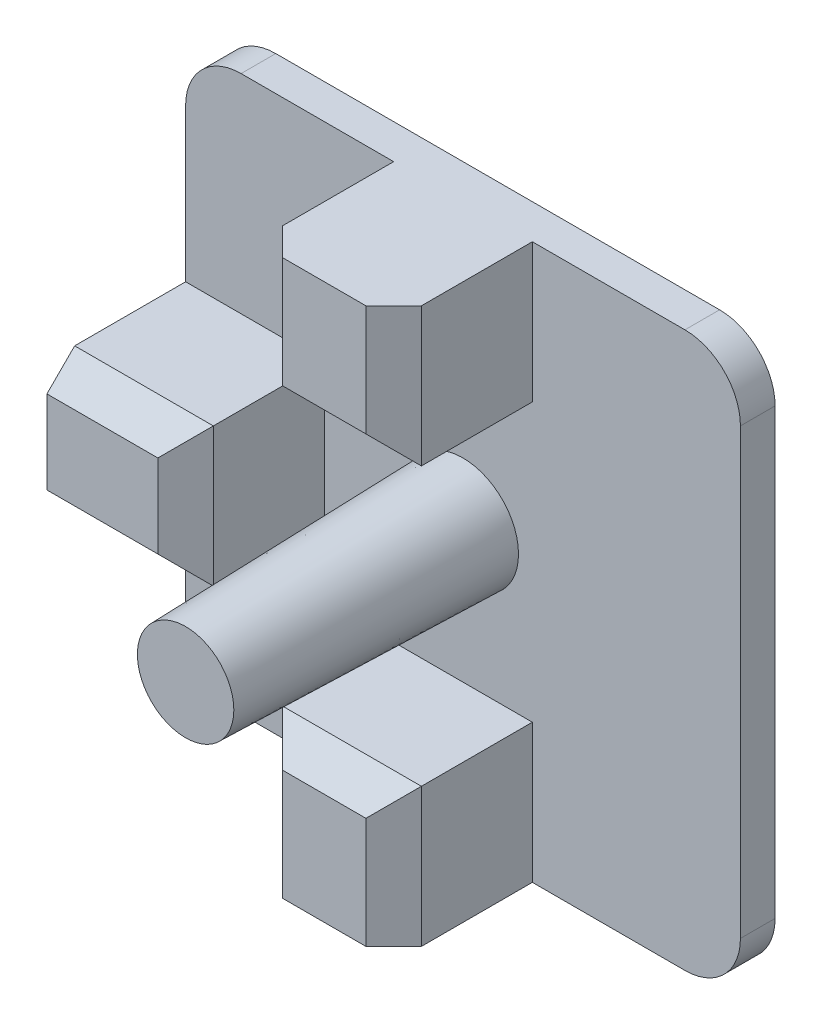
from build123d import *

# Parameters (mm, degrees)
BOSS_EXTRUDE1_DEPTH = 1.5875
SKETCH2_W           = 6.35
SKETCH2_H           = 6.35
BOSS_EXTRUDE3_DEPTH = 6.35
SKETCH2_4_R         = 2.54
BOSS_EXTRUDE4_DEPTH = 12.7
BOSS_EXTRUDE4_TAPER = 1.5
CHAMFER1_SIZE       = 1.27
CUT_EXTRUDE1_DEPTH  = 0.6


with BuildPart() as part:
    # Sketch1 → Boss-Extrude1 (new body)
    with BuildSketch(Plane.XY):
        with BuildLine():
            Line((-10.16, 12.7), (10.16, 12.7))
            ThreePointArc((10.16, 12.7), (11.956051224, 11.956051224), (12.7, 10.16))
            Line((12.7, 10.16), (12.7, -10.16))
            ThreePointArc((12.7, -10.16), (11.956051224, -11.956051224), (10.16, -12.7))
            Line((10.16, -12.7), (-10.16, -12.7))
            ThreePointArc((-10.16, -12.7), (-11.956051224, -11.956051224), (-12.7, -10.16))
            Line((-12.7, -10.16), (-12.7, 10.16))
            ThreePointArc((-12.7, 10.16), (-11.956051224, 11.956051224), (-10.16, 12.7))
        make_face()
    extrude(amount=BOSS_EXTRUDE1_DEPTH)

    # Sketch2 → Boss-Extrude3 (add)
    with BuildSketch(Plane.XY.offset(1.5875)):
        with Locations((-9.525, 0)):
            Rectangle(SKETCH2_W, SKETCH2_H)
        with Locations((0, 9.525)):
            Rectangle(SKETCH2_W, SKETCH2_H)
        with Locations((0, -9.525)):
            Rectangle(SKETCH2_W, SKETCH2_H)
    extrude(amount=BOSS_EXTRUDE3_DEPTH)

    # Sketch2<4> → Boss-Extrude4 (add)
    with BuildSketch(Plane.XY.offset(1.5875)):
        Circle(SKETCH2_4_R)
    extrude(amount=BOSS_EXTRUDE4_DEPTH, taper=BOSS_EXTRUDE4_TAPER)

    # Chamfer1
    chamfer1_edges = [part.edges().sort_by_distance(p)[0] for p in [
        (3.175, 9.525, 7.9375),
        (-3.175, 9.525, 7.9375),
        (0, 6.35, 7.9375),
        (-9.525, -3.175, 7.9375),
        (-9.525, 3.175, 7.9375),
        (-6.35, 0, 7.9375),
        (-3.175, -9.525, 7.9375),
        (3.175, -9.525, 7.9375),
        (0, -6.35, 7.9375),
    ]]
    chamfer(chamfer1_edges, length=CHAMFER1_SIZE)

    # Sketch5 → Cut-Extrude1 (cut)
    with BuildSketch(Plane(origin=(0, 0, 0), x_dir=(-1, 0, 0), z_dir=(0, 0, -1))):
        with BuildLine():
            Line((4.9486325, -0.26640625), (4.80566375, 0.53828125))
            Line((4.80566375, 0.53828125), (7.23847625, 0.971875))
            add(Edge.make_bspline(
                [(7.23847625, 0.971875), (7.265300976, 0.977767208), (7.316553027, 0.98902502), (7.386417313, 1.019177205), (7.445975061, 1.058502989), (7.493162343, 1.108540184), (7.528992616, 1.165738145), (7.550544903, 1.23017609), (7.557529133, 1.300086011), (7.551660972, 1.347437558), (7.5486325, 1.371875)],
                knots=[0, 0, 0, 0, 1.152901184, 2.202764348, 3.180935335, 4.133822457, 5.073078543, 5.997854462, 6.966721939, 8, 8, 8, 8], degree=3))
            add(Edge.make_bspline(
                [(7.5486325, 1.371875), (7.542792734, 1.396646864), (7.531543792, 1.444364066), (7.499884848, 1.509487744), (7.454949308, 1.56317803), (7.398478733, 1.60483656), (7.332490711, 1.634793548), (7.257954774, 1.652000254), (7.175330842, 1.654723907), (7.118865714, 1.646499876), (7.0892575, 1.6421875)],
                knots=[0, 0, 0, 0, 1.012727317, 1.950782296, 2.857509254, 3.77751689, 4.725405478, 5.727859725, 6.808574103, 8, 8, 8, 8], degree=3))
            Line((7.0892575, 1.6421875), (4.68535125, 1.2140625))
            Line((4.68535125, 1.2140625), (4.5423825, 2.0140625))
            Line((4.5423825, 2.0140625), (6.80957, 2.41796875))
            add(Edge.make_bspline(
                [(6.80957, 2.41796875), (6.847301022, 2.424146941), (6.920798591, 2.436181655), (7.028827458, 2.450649053), (7.132077261, 2.459484809), (7.230377946, 2.462125573), (7.323482356, 2.462111249), (7.411390055, 2.455615921), (7.494373236, 2.444838372), (7.572748366, 2.429389837), (7.646448474, 2.408717161), (7.716207008, 2.384988312), (7.781584312, 2.355523785), (7.843339322, 2.322401348), (7.900437373, 2.283618978), (7.954078202, 2.241438319), (8.003198202, 2.194332728), (8.049039105, 2.142989061), (8.091852626, 2.08646838), (8.129838889, 2.022351846), (8.165519605, 1.952395345), (8.198803926, 1.875824466), (8.227849252, 1.79261502), (8.254630893, 1.702985573), (8.278091348, 1.606760444), (8.290616987, 1.539909376), (8.29707, 1.50546875)],
                knots=[0, 0, 0, 0, 1.359771566, 2.6487463, 3.875560241, 5.043152735, 6.145362645, 7.185342953, 8.175634619, 9.120170991, 10.023483318, 10.896369062, 11.738034426, 12.571094417, 13.385408157, 14.189651898, 14.995440776, 15.802293543, 16.635868245, 17.512676209, 18.448819778, 19.4278293, 20.479498143, 21.58131884, 22.753933261, 24, 24, 24, 24], degree=3))
            add(Edge.make_bspline(
                [(8.29707, 1.50546875), (8.305210474, 1.455050803), (8.320925979, 1.357716981), (8.329931619, 1.215241739), (8.328455647, 1.08238611), (8.313760468, 0.959261373), (8.287286964, 0.845690636), (8.249314931, 0.741543137), (8.197917555, 0.647303084), (8.133510725, 0.562431816), (8.055481633, 0.485597873), (7.962511247, 0.415961042), (7.855316021, 0.351113951), (7.732146849, 0.29300798), (7.594525824, 0.238879505), (7.440966494, 0.192076113), (7.272810918, 0.149653692), (7.155016591, 0.127243683), (7.093945, 0.115625)],
                knots=[0, 0, 0, 0, 1.145854088, 2.212116218, 3.200227274, 4.124728484, 4.989683175, 5.812791959, 6.605465325, 7.389991602, 8.19606755, 9.055433262, 9.991834628, 11.003714112, 12.108834738, 13.308838049, 14.604741461, 16, 16, 16, 16], degree=3))
            Line((7.093945, 0.115625), (4.9486325, -0.26640625))
        make_face()
        Polygon((3.922449744, 2.991612413), (3.279480994, 3.486924913), (3.716980994, 5.725987413), (3.506824744, 5.406456163), (2.494324744, 4.091612413), (1.858387244, 4.581456163), (4.016980994, 7.384581163), (4.670105994, 6.881456163), (4.235730994, 4.680674913), (4.487293494, 5.041612413), (5.444324744, 6.284581163), (6.081043494, 5.794737413), align=None)
        Polygon((0.751771392, 4.872631367), (-0.046666108, 4.808568867), (-0.151353608, 6.114037617), (-0.860728608, 6.057006367), (-0.756041108, 4.751537617), (-1.555259858, 4.687475117), (-1.838072358, 8.207787617), (-1.038853608, 8.271850117), (-0.920884858, 6.808568867), (-0.211509858, 6.865600117), (-0.329478608, 8.328881367), (0.468958892, 8.392943867), align=None)
        with BuildLine():
            Line((-4.920123047, 0.595953898), (-4.826373047, -0.216546102))
            Line((-4.826373047, -0.216546102), (-7.281841797, -0.500139852))
            add(Edge.make_bspline(
                [(-7.281841797, -0.500139852), (-7.309101197, -0.504525377), (-7.360946713, -0.512866345), (-7.433457472, -0.537944408), (-7.494816887, -0.575051172), (-7.546014611, -0.621374599), (-7.58371574, -0.677092597), (-7.60964659, -0.739143074), (-7.620413138, -0.808422775), (-7.617655389, -0.855861805), (-7.616216797, -0.880608602)],
                knots=[0, 0, 0, 0, 1.159219096, 2.204755514, 3.2015425, 4.154328068, 5.083365855, 6.006192735, 6.959920939, 8, 8, 8, 8], degree=3))
            add(Edge.make_bspline(
                [(-7.616216797, -0.880608602), (-7.612087451, -0.905893532), (-7.604148383, -0.954506266), (-7.575100674, -1.020839716), (-7.534253977, -1.077316595), (-7.481121861, -1.123145326), (-7.416677768, -1.156966932), (-7.343032738, -1.17758862), (-7.260835581, -1.186561346), (-7.203967434, -1.181637993), (-7.174029297, -1.179046102)],
                knots=[0, 0, 0, 0, 1.017435699, 1.956118989, 2.854725016, 3.774173801, 4.725671501, 5.730437334, 6.805192659, 8, 8, 8, 8], degree=3))
            Line((-7.174029297, -1.179046102), (-4.747466797, -0.898577352))
            Line((-4.747466797, -0.898577352), (-4.653716797, -1.705608602))
            Line((-4.653716797, -1.705608602), (-6.941998047, -1.969671102))
            add(Edge.make_bspline(
                [(-6.941998047, -1.969671102), (-6.979984517, -1.973970995), (-7.054264745, -1.982379176), (-7.163293427, -1.988062587), (-7.26697771, -1.990520486), (-7.365314035, -1.989642819), (-7.458349703, -1.98213365), (-7.546070479, -1.971662701), (-7.628308, -1.956064631), (-7.705372141, -1.935810731), (-7.777531248, -1.910521256), (-7.845471851, -1.881756251), (-7.909354744, -1.849199201), (-7.967768966, -1.810775982), (-8.024153378, -1.77089027), (-8.074289427, -1.724361899), (-8.121150212, -1.674806826), (-8.163586952, -1.620459759), (-8.202165452, -1.560662167), (-8.236382549, -1.494529965), (-8.267543902, -1.42243798), (-8.295950134, -1.344038488), (-8.319549412, -1.258986625), (-8.34078426, -1.167787102), (-8.358911173, -1.070332781), (-8.367350833, -1.002796217), (-8.371685547, -0.968108602)],
                knots=[0, 0, 0, 0, 1.358401368, 2.656271125, 3.878299373, 5.04462664, 6.149164663, 7.193836517, 8.183125754, 9.121533832, 10.023068678, 10.89808339, 11.74255937, 12.566705813, 13.381233575, 14.193707968, 14.992572825, 15.803516984, 16.640452849, 17.518106834, 18.446603811, 19.430292147, 20.479137631, 21.581463121, 22.757809497, 24, 24, 24, 24], degree=3))
            add(Edge.make_bspline(
                [(-8.371685547, -0.968108602), (-8.376692516, -0.917117039), (-8.386333471, -0.818932436), (-8.386759784, -0.675990175), (-8.377418654, -0.543614299), (-8.355773496, -0.421440498), (-8.322080643, -0.309778046), (-8.277818396, -0.20797594), (-8.221146313, -0.116958382), (-8.151436375, -0.036551913), (-8.06887484, 0.035456823), (-7.971669117, 0.099177126), (-7.860478577, 0.157273079), (-7.734332484, 0.208492142), (-7.59306219, 0.252557661), (-7.437233214, 0.290507962), (-7.26667048, 0.322596301), (-7.147559299, 0.337973891), (-7.085748047, 0.345953898)],
                knots=[0, 0, 0, 0, 1.149100472, 2.212600804, 3.203039271, 4.123413217, 4.990373702, 5.81446832, 6.607288663, 7.386227576, 8.193727073, 9.05753109, 9.988014473, 11.004768982, 12.108042928, 13.305595731, 14.601772712, 16, 16, 16, 16], degree=3))
            Line((-7.085748047, 0.345953898), (-4.920123047, 0.595953898))
        make_face()
        Polygon((-4.129712078, -2.712198334), (-3.524243328, -3.249698334), (-4.114868328, -5.448135834), (-3.883618328, -5.143448334), (-2.785180828, -3.905948334), (-2.185962078, -4.437979584), (-4.529712078, -7.077823334), (-5.144555828, -6.531729584), (-4.558618328, -4.371573334), (-4.834399578, -4.712979584), (-5.874243328, -5.884073334), (-6.473462078, -5.352042084), align=None)
        Polygon((-1.040071044, -4.84243991), (-0.240071044, -4.84243991), (-0.240071044, -6.14243991), (0.409928956, -6.14243991), (0.409928956, -4.84243991), (1.209928956, -4.84243991), (1.209928956, -8.34243991), (0.409928956, -8.34243991), (0.409928956, -6.89243991), (-0.240071044, -6.89243991), (-0.240071044, -8.34243991), (-1.040071044, -8.34243991), align=None)
    extrude(amount=-CUT_EXTRUDE1_DEPTH, mode=Mode.SUBTRACT)


solid = part.part
